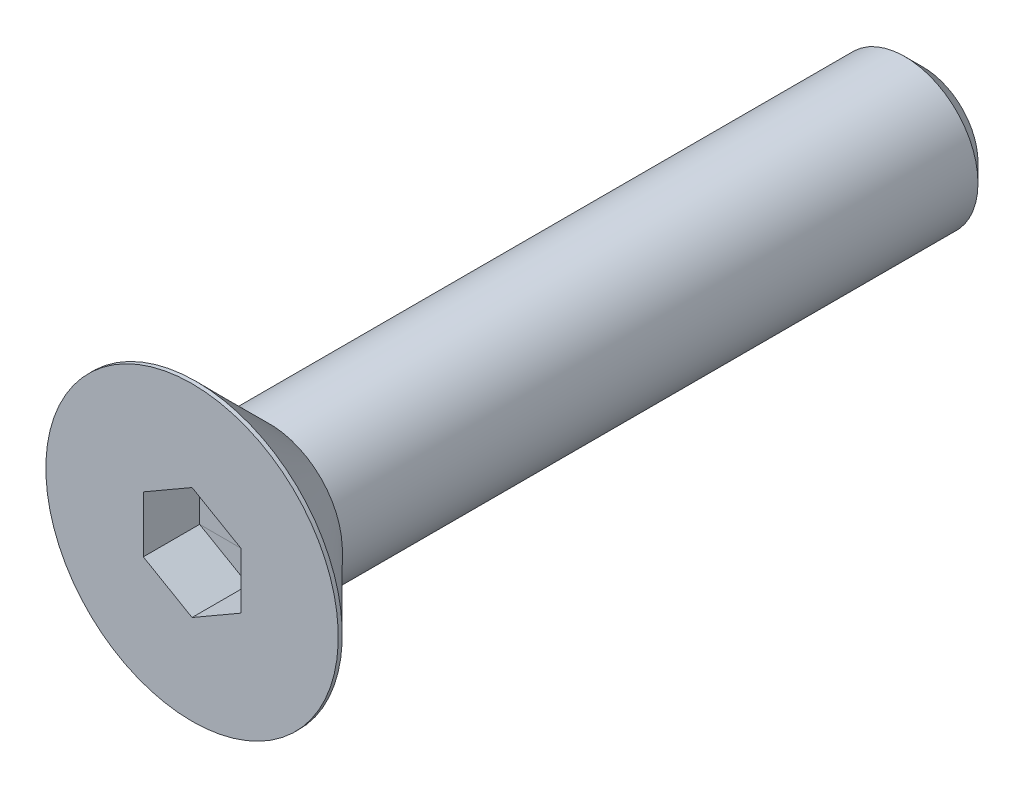
from build123d import *

# Parameters (mm, degrees)
CHAMFER1_SIZE      = 0.75
CUT_EXTRUDE2_DEPTH = 2.31


with BuildPart() as part:
    # Sketch1 → Revolve1 (revolve)
    with BuildSketch(Plane(origin=(0, 0, 0), x_dir=(0, 0, -1), z_dir=(1, 0, 0))):
        Polygon((-11.7, 3), (15, 3), (15, 0), (-12.69, 0), (-12.69, 3), align=None)
    revolve(axis=Axis((0, 0, 12.69), (0, 0, -1)))

    # Chamfer1
    chamfer1_edges = [part.edges().sort_by_distance(p)[0] for p in [
        (0, -3, -15),
    ]]
    chamfer(chamfer1_edges, length=CHAMFER1_SIZE)


with BuildPart() as body_2:
    # Sketch7 → Revolve2 (revolve)
    with BuildSketch(Plane(origin=(0, 0, 0), x_dir=(0, 0, -1), z_dir=(1, 0, 0))):
        Polygon((-14.835, 6), (-15, 6), (-15, 0), (-11.7, 0), (-11.7, 2.865), align=None)
    revolve(axis=Axis((0, 0, 15), (0, 0, -1)))

    # Sketch5 → Cut-Extrude2 (cut)
    with BuildSketch(Plane.XY.offset(15)):
        Polygon((2, -1.154700538), (2, 1.154700538), (0, 2.309401077), (-2, 1.154700538), (-2, -1.154700538), (0, -2.309401077), align=None)
    extrude(amount=-CUT_EXTRUDE2_DEPTH, mode=Mode.SUBTRACT)


solid = Compound([part.part, body_2.part])
